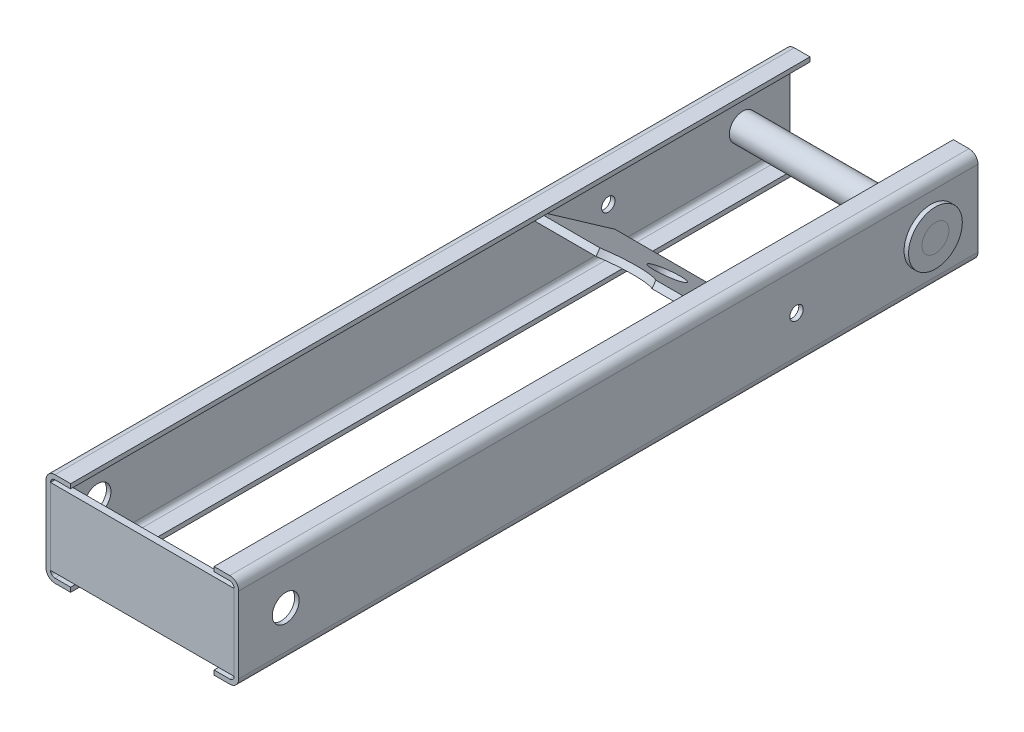
from build123d import *

# Parameters (mm, degrees)
EXTRUDE_1_DEPTH          = 330
EXTRUDE_1_2_DEPTH        = 330
EXTRUDE_2_REACH          = 343.17
SKETCH_3_W               = 3
SKETCH_3_H               = 34
EXTRUDE_3_REACH          = 343.17
CUT_EXTRUDE_1_DEPTH      = 342.667967477
CUT_EXTRUDE_1_DEPTH_BACK = 342.667967477
SKETCH_5_R               = 6
SKETCH_5_R_2             = 3
SKETCH_6_R               = 7
CUT_EXTRUDE_2_DEPTH      = 3
SKETCH_7_R               = 12
SKETCH_7_R_2             = 6
EXTRUDE_4_DEPTH          = 2
SKETCH_8_R               = 6
EXTRUDE_5_DEPTH          = 90
SKETCH_9_R               = 12
SKETCH_9_R_2             = 6
EXTRUDE_6_DEPTH          = 2


with BuildPart() as part:
    # Эскиз2 → Бобышка-Вытянуть1 (new body)
    with BuildSketch(Plane.XY):
        with BuildLine():
            Line((43, -17), (43, 17))
            ThreePointArc((43, 17), (41.828427125, 19.828427125), (39, 21))
            Line((39, 21), (32, 21))
            Line((32, 21), (32, 19))
            Line((32, 19), (39, 19))
            ThreePointArc((39, 19), (40.414213562, 18.414213562), (41, 17))
            Line((41, 17), (41, -17))
            ThreePointArc((41, -17), (40.414213562, -18.414213562), (39, -19))
            Line((39, -19), (32, -19))
            Line((32, -19), (32, -21))
            Line((32, -21), (39, -21))
            ThreePointArc((39, -21), (41.828427125, -19.828427125), (43, -17))
        make_face()
    extrude(amount=-EXTRUDE_1_DEPTH)


with BuildPart() as body_2:
    # Эскиз2 → Extrude 1 2 (new body)
    with BuildSketch(Plane.XY):
        with BuildLine():
            Line((-32, 19), (-32, 21))
            Line((-32, 21), (-39, 21))
            ThreePointArc((-39, 21), (-41.828427125, 19.828427125), (-43, 17))
            Line((-43, 17), (-43, -17))
            ThreePointArc((-43, -17), (-41.828427125, -19.828427125), (-39, -21))
            Line((-39, -21), (-32, -21))
            Line((-32, -21), (-32, -19))
            Line((-32, -19), (-39, -19))
            ThreePointArc((-39, -19), (-40.414213562, -18.414213562), (-41, -17))
            Line((-41, -17), (-41, 17))
            ThreePointArc((-41, 17), (-40.414213562, 18.414213562), (-39, 19))
            Line((-39, 19), (-32, 19))
        make_face()
    extrude(amount=-EXTRUDE_1_2_DEPTH)


with BuildPart() as body_3:

    # Эскиз3 → Бобышка-Вытянуть2 (new, up to next)
    with BuildSketch(Plane(origin=(-41, 0, 0), x_dir=(0, 0, -1), z_dir=(1, 0, 0)), mode=Mode.PRIVATE) as extrude_2_sk1:
        with Locations((1.5, 0)):
            Rectangle(SKETCH_3_W, SKETCH_3_H)
    extrude_2_tool1 = extrude(extrude_2_sk1.sketch, amount=EXTRUDE_2_REACH, mode=Mode.PRIVATE) - part.part
    add(extrude_2_tool1.solids().sort_by_distance((-41, 0, -1.5))[0])


with BuildPart() as part_1:
    add(part.part)

    # Эскиз4 → Бобышка-Вытянуть3 (add, up to next)
    with BuildSketch(Plane(origin=(-41, 0, 0), x_dir=(0, 0, -1), z_dir=(1, 0, 0)), mode=Mode.PRIVATE) as extrude_3_sk1:
        Polygon((215, 11.103165315), (250.223537904, -13.560621448), (251.944267213, -11.103165315), (216.720729309, 13.560621448), align=None)
    extrude_3_tool1 = extrude(extrude_3_sk1.sketch, amount=EXTRUDE_3_REACH, mode=Mode.PRIVATE) - part_1.part

    add(body_2.part)  # Бобышка-Вытянуть3 merges body 2
    add(extrude_3_tool1.solids().sort_by_distance((-41, 0, -233.472134))[0])

    # Эскиз5 → Вырез-Вытянуть1 (cut, two sides: drawn at the far end of the back side and taken through both)
    with BuildSketch(Plane(origin=(43, 0, 0), x_dir=(0, 0, -1), z_dir=(1, 0, 0)).offset(-CUT_EXTRUDE_1_DEPTH_BACK)):
        with Locations((309, 0)):
            Circle(SKETCH_5_R)
        with Locations((21, 0)):
            Circle(SKETCH_5_R)
        with Locations((249, 0)):
            Circle(SKETCH_5_R_2)
    extrude(amount=CUT_EXTRUDE_1_DEPTH + CUT_EXTRUDE_1_DEPTH_BACK, mode=Mode.SUBTRACT)

    # Эскиз6 → Вырез-Вытянуть2 (cut)
    with BuildSketch(Plane(origin=(0, 110.924748621, -77.670345159), x_dir=(1, 0, 0), z_dir=(0, 0.8191520442889955, -0.5735764363510407))):
        with Locations(Location((0, 191.249175528, 0), (0, 0, 270))):
            Circle(SKETCH_6_R)
        with BuildLine():
            Line((-12.5, 169.749175528), (12.5, 169.749175528))
            ThreePointArc((12.5, 169.749175528), (0, 174.749175528), (-12.5, 169.749175528))
        make_face()
    extrude(amount=-CUT_EXTRUDE_2_DEPTH, mode=Mode.SUBTRACT)


with BuildPart() as body_3_2:
    # Эскиз7 → Бобышка-Вытянуть4 (new body)
    with BuildSketch(Plane(origin=(43, 0, 0), x_dir=(0, 0, -1), z_dir=(1, 0, 0))):
        with Locations((309, 0)):
            Circle(SKETCH_7_R)
        with Locations((309, 0)):
            Circle(SKETCH_7_R_2, mode=Mode.SUBTRACT)
    extrude(amount=EXTRUDE_4_DEPTH)


with BuildPart() as body_4:
    # Эскиз8 → Бобышка-Вытянуть5 (new body)
    with BuildSketch(Plane(origin=(45, 0, 0), x_dir=(0, 0, -1), z_dir=(1, 0, 0))):
        with Locations((309, 0)):
            Circle(SKETCH_8_R)
    extrude(amount=-EXTRUDE_5_DEPTH)


with BuildPart() as body_5:
    # Эскиз9 → Бобышка-Вытянуть6 (new body)
    with BuildSketch(Plane.ZY.offset(43)):
        with Locations((-309, 0)):
            Circle(SKETCH_9_R)
        with Locations((-309, 0)):
            Circle(SKETCH_9_R_2, mode=Mode.SUBTRACT)
    extrude(amount=EXTRUDE_6_DEPTH)


solid = Compound([body_3.part, part_1.part, body_3_2.part, body_4.part, body_5.part])
